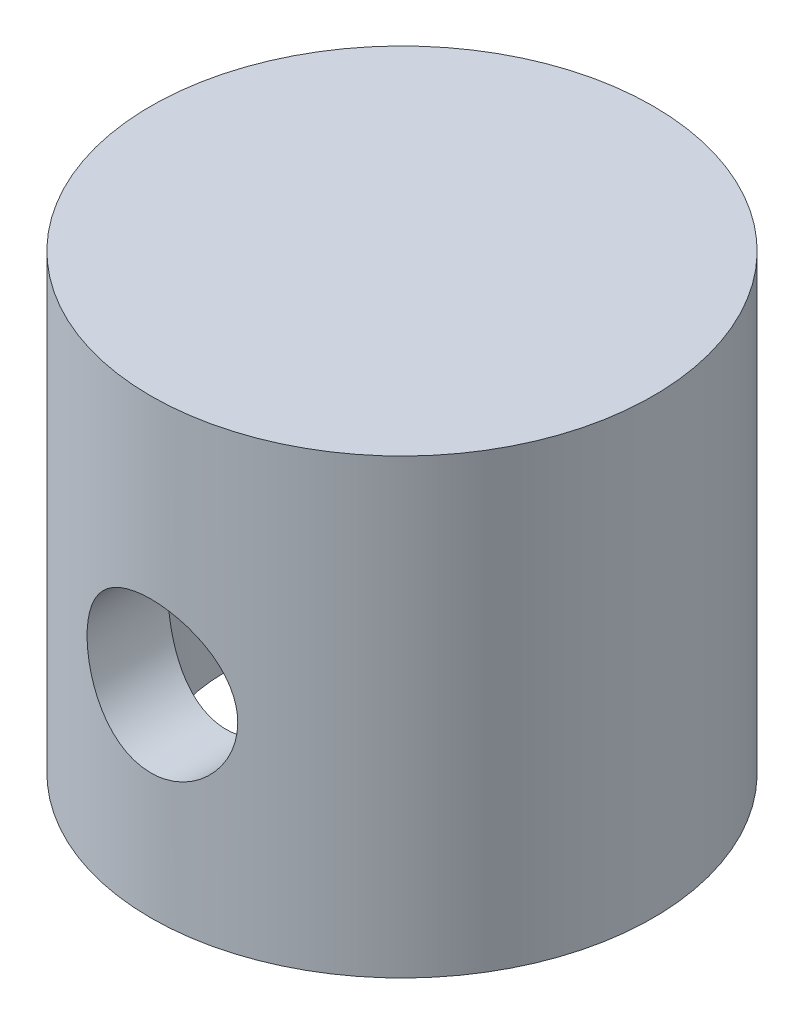
from build123d import *

# Parameters (mm, degrees)
SKETCH1_R               = 10
BOSS_EXTRUDE1_DEPTH     = 18
SKETCH2_R               = 7
CUT_EXTRUDE1_DEPTH      = 15
CUT_EXTRUDE3_DEPTH      = 23.891046285
CUT_EXTRUDE3_DEPTH_BACK = 23.891046285
SKETCH4_R               = 3
FILLET1_R               = 1


with BuildPart() as part:
    # Sketch1 → Boss-Extrude1 (new body)
    with BuildSketch(Plane(origin=(0, 0, 0), x_dir=(1, 0, 0), z_dir=(0, 1, 0))):
        with Locations(Location((0, 0, 0), (0, 0, 270))):
            Circle(SKETCH1_R)
    extrude(amount=BOSS_EXTRUDE1_DEPTH)

    # Sketch2 → Cut-Extrude1 (cut)
    with BuildSketch(Plane(origin=(0, 0, 0), x_dir=(-1, 0, 0), z_dir=(0, -1, 0))):
        with Locations(Location((0, 0, 0), (0, 0, 90))):
            Circle(SKETCH2_R)
    extrude(amount=-CUT_EXTRUDE1_DEPTH, mode=Mode.SUBTRACT)

    # Sketch4 → Cut-Extrude3 (cut, two sides: drawn at the far end of the back side and taken through both)
    with BuildSketch(Plane.XY.offset(-CUT_EXTRUDE3_DEPTH_BACK)):
        with Locations((0, 8)):
            Circle(SKETCH4_R)
    extrude(amount=CUT_EXTRUDE3_DEPTH + CUT_EXTRUDE3_DEPTH_BACK, mode=Mode.SUBTRACT)

    # Fillet1
    fillet1_edges = [part.edges().sort_by_distance(p)[0] for p in [
        (0, 15, 7),
    ]]
    fillet(fillet1_edges, radius=FILLET1_R)


solid = part.part
